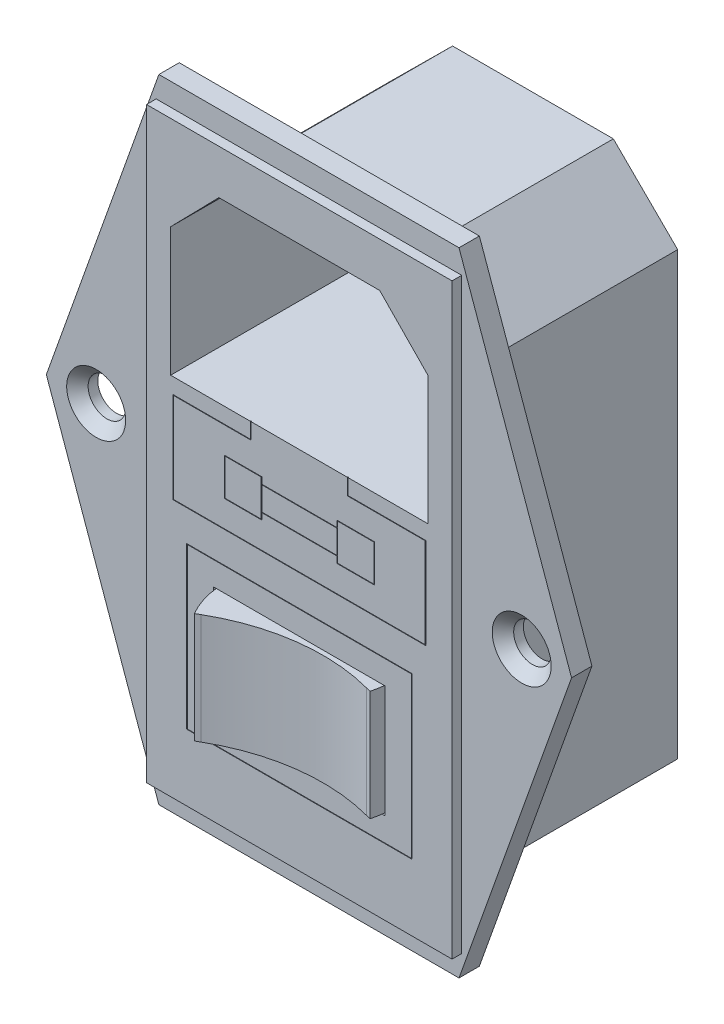
from build123d import *

# Parameters (mm, degrees)
SKETCH1_R           = 1.75
BOSS_EXTRUDE1_DEPTH = 1.9
SKETCH2_W           = 28.5
SKETCH2_H           = 54.8
BOSS_EXTRUDE2_DEPTH = 0.9
CHAMFER1_SIZE       = 1
BOSS_EXTRUDE3_DEPTH = 19
CUT_EXTRUDE1_DEPTH  = 18.3
SKETCH5_W           = 3.5
SKETCH5_H           = 3.5
SKETCH5_W_2         = 3.4
SKETCH5_H_2         = 3.4
SKETCH5_W_3         = 7
SKETCH5_H_3         = 0.05
SKETCH5_W_4         = 21
SKETCH5_H_4         = 15
SKETCH5_W_5         = 20.9
SKETCH5_H_5         = 14.9
CUT_EXTRUDE2_DEPTH  = 0.05
SKETCH6_W           = 24
SKETCH6_H           = 15.5
CUT_EXTRUDE3_DEPTH  = 19
CUT_EXTRUDE4_DEPTH  = 1.25
SKETCH8_W           = 20
SKETCH8_H           = 13
BOSS_EXTRUDE4_DEPTH = 14
SKETCH5_3_W         = 16
SKETCH5_3_H         = 10.5
CUT_EXTRUDE6_DEPTH  = 1
SKETCH10_W          = 7.9
SKETCH10_H          = 10.3
REVOLVE2_ANGLE      = 30
SKETCH10_6_W        = 7.9
SKETCH10_6_H        = 10.3
REVOLVE3_ANGLE      = 15
FILLET1_R           = 18


with BuildPart() as part:
    # Sketch1 → Boss-Extrude1 (new body)
    with BuildSketch(Plane.XY):
        Polygon((-24.5, 0), (-14, 29.5), (14, 29.5), (24.5, 0), (14, -29.5), (-14, -29.5), align=None)
        with Locations(Location((-19.85, 0, 0), (0, 0, 180))):
            Circle(SKETCH1_R, mode=Mode.SUBTRACT)
        with Locations(Location((19.85, 0, 0), (0, 0, 180))):
            Circle(SKETCH1_R, mode=Mode.SUBTRACT)
    extrude(amount=BOSS_EXTRUDE1_DEPTH)

    # Sketch2 → Boss-Extrude2 (add)
    with BuildSketch(Plane.XY.offset(1.9)):
        Rectangle(SKETCH2_W, SKETCH2_H)
    extrude(amount=BOSS_EXTRUDE2_DEPTH)

    # Chamfer1
    chamfer1_edges = [part.edges().sort_by_distance(p)[0] for p in [
        (-18.1, 0, 1.9),
        (21.6, 0, 1.9),
    ]]
    chamfer(chamfer1_edges, length=CHAMFER1_SIZE)

    # Sketch3 → Boss-Extrude3 (add)
    with BuildSketch(Plane(origin=(0, 0, 0), x_dir=(-1, 0, 0), z_dir=(0, 0, -1))):
        Polygon((7.5, 24.6), (-7.5, 24.6), (-13.5, 18.65), (-13.5, -22.5), (13.5, -22.5), (13.5, 18.65), align=None)
    extrude(amount=BOSS_EXTRUDE3_DEPTH)

    # Sketch4 → Cut-Extrude1 (cut)
    with BuildSketch(Plane.XY.offset(2.8)):
        Polygon((7.5, 23.25), (-7.5, 23.25), (-12, 18.65), (-12, 6.65), (12, 6.65), (12, 18.65), align=None)
    extrude(amount=-CUT_EXTRUDE1_DEPTH, mode=Mode.SUBTRACT)

    # Sketch5 → Cut-Extrude2 (cut)
    # profile 1 of 6: a face of its own
    with BuildSketch(Plane.XY.offset(2.8)):
        with Locations((-5.25, 0.95)):
            Rectangle(SKETCH5_W, SKETCH5_H)
        with Locations((-5.25, 0.95)):
            Rectangle(SKETCH5_W_2, SKETCH5_H_2, mode=Mode.SUBTRACT)
    # profile 2 of 6: a face of its own
    with BuildSketch(Plane.XY.offset(2.8)):
        Polygon((-3.5, 2.05), (0, 2.05), (3.5, 2.05), (3.5, 2.1), (0, 2.1), (-3.5, 2.1), align=None)
    # profile 3 of 6: a face of its own
    with BuildSketch(Plane.XY.offset(2.8)):
        with Locations((0, -0.175)):
            Rectangle(SKETCH5_W_3, SKETCH5_H_3)
    # profile 4 of 6: a face of its own
    with BuildSketch(Plane.XY.offset(2.8)):
        with Locations((5.25, 0.95)):
            Rectangle(SKETCH5_W, SKETCH5_H)
        with Locations((5.25, 0.95)):
            Rectangle(SKETCH5_W_2, SKETCH5_H_2, mode=Mode.SUBTRACT)
    # profile 5 of 6: a face of its own
    with BuildSketch(Plane.XY.offset(2.8)):
        with Locations((0, -13.7)):
            Rectangle(SKETCH5_W_4, SKETCH5_H_4)
        with Locations((0, -13.7)):
            Rectangle(SKETCH5_W_5, SKETCH5_H_5, mode=Mode.SUBTRACT)
    # profile 6 of 6: a face of its own
    with BuildSketch(Plane.XY.offset(2.8)):
        Polygon((-4.5, 6.65), (-4.5, 5.15), (-11.75, 5.15), (-11.75, -3.25), (11.75, -3.25), (11.75, 5.15), (4.5, 5.15), (4.5, 6.65), (4.55, 6.65), (4.55, 5.2), (11.8, 5.2), (11.8, -3.3), (-11.8, -3.3), (-11.8, 5.2), (-4.55, 5.2), (-4.55, 6.65), align=None)
    extrude(amount=-CUT_EXTRUDE2_DEPTH, mode=Mode.SUBTRACT)

    # Sketch6 → Cut-Extrude3 (cut)
    with BuildSketch(Plane(origin=(0, 0, -19), x_dir=(-1, 0, 0), z_dir=(0, 0, -1))):
        with Locations((0, -13.5)):
            Rectangle(SKETCH6_W, SKETCH6_H)
    extrude(amount=-CUT_EXTRUDE3_DEPTH, mode=Mode.SUBTRACT)

    # Sketch7 → Cut-Extrude4 (cut)
    with BuildSketch(Plane.XZ.offset(22.5)):
        Polygon((8.5, -19), (4.458548116, -12), (-4.458548116, -12), (-8.5, -19), align=None)
    extrude(amount=-CUT_EXTRUDE4_DEPTH, mode=Mode.SUBTRACT)

    # Sketch8 → Boss-Extrude4 (add)
    with BuildSketch(Plane(origin=(0, 0, 0), x_dir=(-1, 0, 0), z_dir=(0, 0, -1))):
        with Locations((0, -13.5)):
            Rectangle(SKETCH8_W, SKETCH8_H)
    extrude(amount=BOSS_EXTRUDE4_DEPTH)

    # Sketch5<3> → Cut-Extrude6 (cut)
    with BuildSketch(Plane.XY.offset(2.8)):
        with Locations((0, -13.7)):
            Rectangle(SKETCH5_3_W, SKETCH5_3_H)
    extrude(amount=-CUT_EXTRUDE6_DEPTH, mode=Mode.SUBTRACT)

    # Sketch10 → Revolve2 (revolve)
    with BuildSketch(Plane.XY.offset(1.8)):
        with Locations((-3.95, -13.7)):
            Rectangle(SKETCH10_W, SKETCH10_H)
    revolve(axis=Axis((0, -8.45, 1.8), (0, 1, 0)), revolution_arc=REVOLVE2_ANGLE)

    # Sketch10<6> → Revolve3 (revolve)
    with BuildSketch(Plane.XY.offset(1.8)):
        with Locations((3.95, -13.7)):
            Rectangle(SKETCH10_6_W, SKETCH10_6_H)
    revolve(axis=Axis((0, -8.45, 1.8), (0, -1, 0)), revolution_arc=REVOLVE3_ANGLE)

    # Fillet1
    fillet1_edges = [part.edges().sort_by_distance(p)[0] for p in [
        (0, -13.7, 1.8),
    ]]
    fillet(fillet1_edges, radius=FILLET1_R)


solid = part.part
